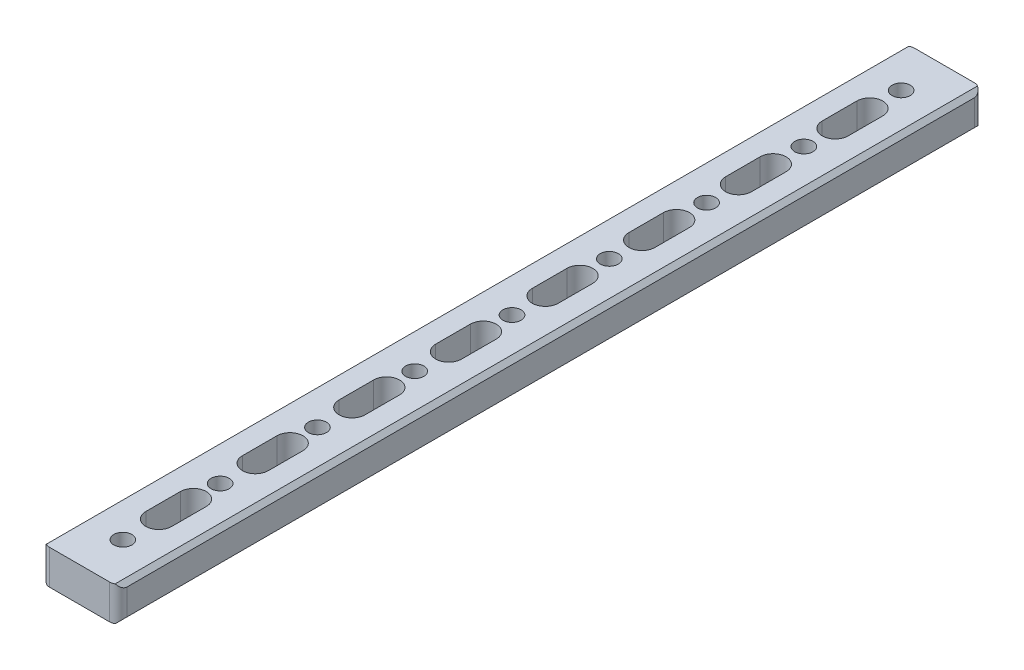
from build123d import *

# Parameters (mm, degrees)
SKETCH_1_W             = 17.9
SKETCH_1_H             = 8
EXTRUDE_1_DEPTH        = 100
SKETCH_2_R             = 1.5
CUT_EXTRUDE_1_DEPTH    = 100
HOLE_WIZARD_M5_1_D     = 4.2
HOLE_WIZARD_M5_1_DEPTH = 12.4
HOLE_WIZARD_M5_1_TIP   = 1.2618073
CHAMFER_1_SIZE         = 1
FILLET_1_R             = 2
HOLE_WIZARD_M5_2_D     = 4.2
HOLE_WIZARD_M5_2_DEPTH = 12.4
HOLE_WIZARD_M5_2_TIP   = 1.2618073
CUT_EXTRUDE_2_DEPTH    = 10


with BuildPart() as part:
    # 草图1 → 凸台-拉伸1 (new, symmetric)
    with BuildSketch(Plane.XY):
        Rectangle(SKETCH_1_W, SKETCH_1_H)
    extrude(amount=EXTRUDE_1_DEPTH, both=True)

    # 草图2 → 切除-拉伸1 (cut, symmetric)
    with BuildSketch(Plane(origin=(0, 4, 0), x_dir=(1, 0, 0), z_dir=(0, 1, 0))):
        with Locations(Location((0, 90, 0), (0, 0, 270))):
            Circle(SKETCH_2_R)
        with Locations(Location((0, 45, 0), (0, 0, 270))):
            Circle(SKETCH_2_R)
        with Locations(Location((0, 0, 0), (0, 0, 270))):
            Circle(SKETCH_2_R)
        with Locations(Location((0, -45, 0), (0, 0, 270))):
            Circle(SKETCH_2_R)
        with Locations(Location((0, -90, 0), (0, 0, 270))):
            Circle(SKETCH_2_R)
    extrude(amount=CUT_EXTRUDE_1_DEPTH, both=True, mode=Mode.SUBTRACT)

    # M5 螺纹孔1
    with Locations(Plane(origin=(0, 4, 0), x_dir=(1, 0, 0), z_dir=(0, 1, 0))):
        with Locations((0, 90), (0, 45), (0, 0), (0, -45), (0, -90)):
            Hole(HOLE_WIZARD_M5_1_D / 2, depth=HOLE_WIZARD_M5_1_DEPTH)
            with Locations((0, 0, -(HOLE_WIZARD_M5_1_DEPTH + HOLE_WIZARD_M5_1_TIP / 2))):  # 118° drill point
                Cone(0, HOLE_WIZARD_M5_1_D / 2, HOLE_WIZARD_M5_1_TIP, mode=Mode.SUBTRACT)

    # 倒角1
    chamfer_1_edges = [part.edges().sort_by_distance(p)[0] for p in [
        (8.95, -4, 0),
        (-8.95, -4, 0),
        (-8.95, 4, 0),
        (8.95, 4, 0),
    ]]
    chamfer(chamfer_1_edges, length=CHAMFER_1_SIZE)

    # 圆角1
    fillet_1_edges = [part.edges().sort_by_distance(p)[0] for p in [
        (8.95, 0, -100),
        (-8.95, 0, -100),
        (-8.95, 0, 100),
        (8.95, 0, 100),
    ]]
    fillet(fillet_1_edges, radius=FILLET_1_R)

    # M5 螺纹孔2
    with Locations(Plane(origin=(0, 4, 0), x_dir=(1, 0, 0), z_dir=(0, 1, 0))):
        with Locations((0, 67.5), (0, 22.5), (0, -22.5), (0, -67.5)):
            Hole(HOLE_WIZARD_M5_2_D / 2, depth=HOLE_WIZARD_M5_2_DEPTH)
            with Locations((0, 0, -(HOLE_WIZARD_M5_2_DEPTH + HOLE_WIZARD_M5_2_TIP / 2))):  # 118° drill point
                Cone(0, HOLE_WIZARD_M5_2_D / 2, HOLE_WIZARD_M5_2_TIP, mode=Mode.SUBTRACT)

    # 草图8 → 切除-拉伸2 (cut)
    with BuildSketch(Plane(origin=(0, 4, 0), x_dir=(1, 0, 0), z_dir=(0, 1, 0))):
        with BuildLine():
            Line((3, 82.75), (3, 74.75))
            ThreePointArc((3, 74.75), (0, 71.75), (-3, 74.75))
            Line((-3, 74.75), (-3, 82.75))
            ThreePointArc((-3, 82.75), (0, 85.75), (3, 82.75))
        make_face()
        with BuildLine():
            Line((3, 60.4), (3, 52.4))
            ThreePointArc((3, 52.4), (0, 49.4), (-3, 52.4))
            Line((-3, 52.4), (-3, 60.4))
            ThreePointArc((-3, 60.4), (0, 63.4), (3, 60.4))
        make_face()
        with BuildLine():
            Line((3, 38.05), (3, 30.05))
            ThreePointArc((3, 30.05), (0, 27.05), (-3, 30.05))
            Line((-3, 30.05), (-3, 38.05))
            ThreePointArc((-3, 38.05), (0, 41.05), (3, 38.05))
        make_face()
        with BuildLine():
            Line((3, 15.7), (3, 7.7))
            ThreePointArc((3, 7.7), (0, 4.7), (-3, 7.7))
            Line((-3, 7.7), (-3, 15.7))
            ThreePointArc((-3, 15.7), (0, 18.7), (3, 15.7))
        make_face()
        with BuildLine():
            Line((3, -6.65), (3, -14.65))
            ThreePointArc((3, -14.65), (0, -17.65), (-3, -14.65))
            Line((-3, -14.65), (-3, -6.65))
            ThreePointArc((-3, -6.65), (0, -3.65), (3, -6.65))
        make_face()
        with BuildLine():
            Line((3, -29), (3, -37))
            ThreePointArc((3, -37), (0, -40), (-3, -37))
            Line((-3, -37), (-3, -29))
            ThreePointArc((-3, -29), (0, -26), (3, -29))
        make_face()
        with BuildLine():
            Line((3, -51.35), (3, -59.35))
            ThreePointArc((3, -59.35), (0, -62.35), (-3, -59.35))
            Line((-3, -59.35), (-3, -51.35))
            ThreePointArc((-3, -51.35), (0, -48.35), (3, -51.35))
        make_face()
        with BuildLine():
            Line((3, -73.7), (3, -81.7))
            ThreePointArc((3, -81.7), (0, -84.7), (-3, -81.7))
            Line((-3, -81.7), (-3, -73.7))
            ThreePointArc((-3, -73.7), (0, -70.7), (3, -73.7))
        make_face()
    extrude(amount=-CUT_EXTRUDE_2_DEPTH, mode=Mode.SUBTRACT)


solid = part.part
